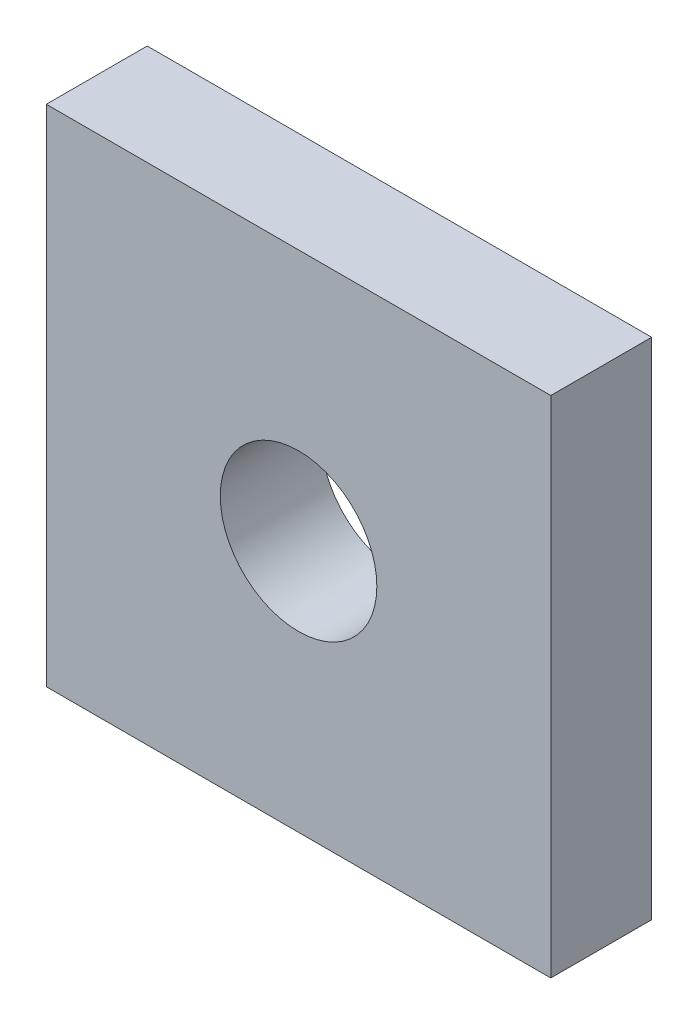
from build123d import *

# Parameters (mm, degrees)
SKETCH1_W           = 350
SKETCH1_H           = 350
BOSS_EXTRUDE1_DEPTH = 70
SKETCH2_R           = 54.315247482
CUT_EXTRUDE1_DEPTH  = 70


with BuildPart() as part:
    # Sketch1 → Boss-Extrude1 (new body)
    with BuildSketch(Plane.XY):
        Rectangle(SKETCH1_W, SKETCH1_H)
    extrude(amount=BOSS_EXTRUDE1_DEPTH)

    # Sketch2 → Cut-Extrude1 (cut)
    with BuildSketch(Plane.XY.offset(70)):
        Circle(SKETCH2_R)
    extrude(amount=-CUT_EXTRUDE1_DEPTH, mode=Mode.SUBTRACT)


solid = part.part
